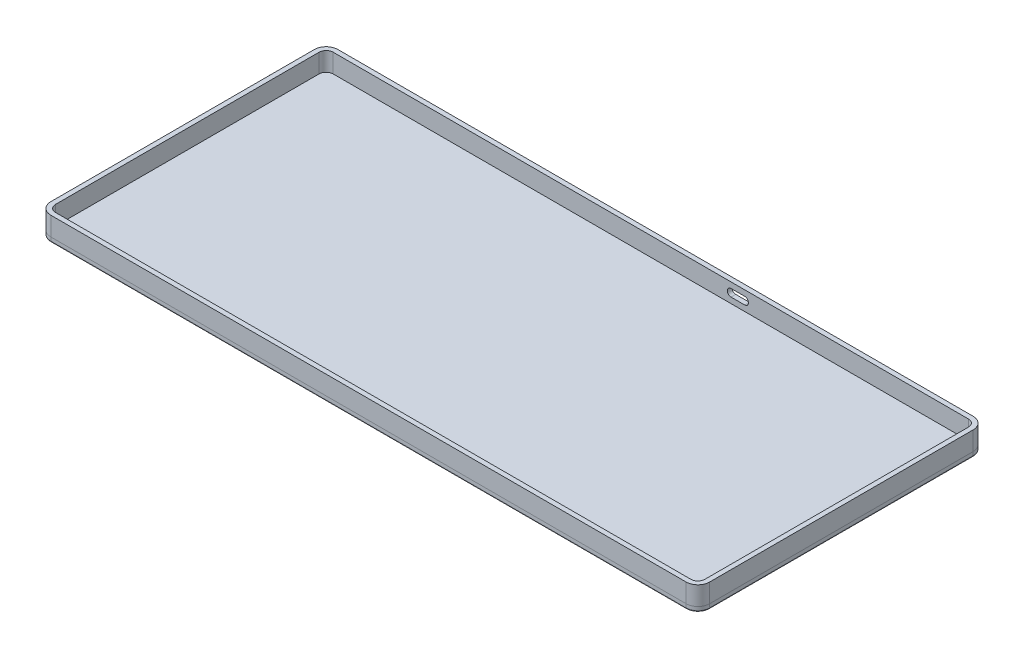
from build123d import *

# Parameters (mm, degrees)
EXTRUDE_1_DEPTH     = 2
EXTRUDE_2_DEPTH     = 8
CUT_EXTRUDE_7_DEPTH = 2
FILLET_1_R          = 0.5


with BuildPart() as part:
    # 草图1 → 凸台-拉伸1 (new body)
    with BuildSketch(Plane(origin=(0, 0, 0), x_dir=(1, 0, 0), z_dir=(0, 1, 0))):
        with BuildLine():
            Line((-135, 61), (135, 61))
            ThreePointArc((135, 61), (138.535533906, 59.535533906), (140, 56))
            Line((140, 56), (140, -56))
            ThreePointArc((140, -56), (138.535533906, -59.535533906), (135, -61))
            Line((135, -61), (-135, -61))
            ThreePointArc((-135, -61), (-138.535533906, -59.535533906), (-140, -56))
            Line((-140, -56), (-140, 56))
            ThreePointArc((-140, 56), (-138.535533906, 59.535533906), (-135, 61))
        make_face()
    extrude(amount=EXTRUDE_1_DEPTH)

    # 圆角1
    fillet_1_edges = [part.edges().sort_by_distance(p)[0] for p in [
        (-140, 0, 0),
        (-138.535533906, 0, -59.535533906),
        (0, 0, -61),
        (138.535533906, 0, -59.535533906),
        (140, 0, 0),
        (138.535533906, 0, 59.535533906),
        (0, 0, 61),
        (-138.535533906, 0, 59.535533906),
    ]]
    fillet(fillet_1_edges, radius=FILLET_1_R)


with BuildPart() as body_2:
    # 草图2 → 凸台-拉伸2 (new body)
    with BuildSketch(Plane(origin=(0, 2, 0), x_dir=(1, 0, 0), z_dir=(0, 1, 0))):
        with BuildLine():
            Line((135, 61), (-135, 61))
            ThreePointArc((-135, 61), (-138.535533906, 59.535533906), (-140, 56))
            Line((-140, 56), (-140, -56))
            ThreePointArc((-140, -56), (-138.535533906, -59.535533906), (-135, -61))
            Line((-135, -61), (135, -61))
            ThreePointArc((135, -61), (138.535533906, -59.535533906), (140, -56))
            Line((140, -56), (140, 56))
            ThreePointArc((140, 56), (138.535533906, 59.535533906), (135, 61))
        make_face()
        with BuildLine():
            Line((135, 59), (-135, 59))
            ThreePointArc((-135, 59), (-137.121320344, 58.121320344), (-138, 56))
            Line((-138, 56), (-138, -56))
            ThreePointArc((-138, -56), (-137.121320344, -58.121320344), (-135, -59))
            Line((-135, -59), (135, -59))
            ThreePointArc((135, -59), (137.121320344, -58.121320344), (138, -56))
            Line((138, -56), (138, 56))
            ThreePointArc((138, 56), (137.121320344, 58.121320344), (135, 59))
        make_face(mode=Mode.SUBTRACT)
    extrude(amount=EXTRUDE_2_DEPTH)

    # 草图3 → 切除-拉伸7 (cut)
    with BuildSketch(Plane(origin=(0, 0, -61), x_dir=(-1, 0, 0), z_dir=(0, 0, -1))):
        with BuildLine():
            Line((-39.915, 7.585), (-34.085, 7.585))
            ThreePointArc((-34.085, 7.585), (-32.5, 6), (-34.085, 4.415))
            Line((-34.085, 4.415), (-39.915, 4.415))
            ThreePointArc((-39.915, 4.415), (-41.5, 6), (-39.915, 7.585))
        make_face()
    extrude(amount=-CUT_EXTRUDE_7_DEPTH, mode=Mode.SUBTRACT)


solid = Compound([part.part, body_2.part])
